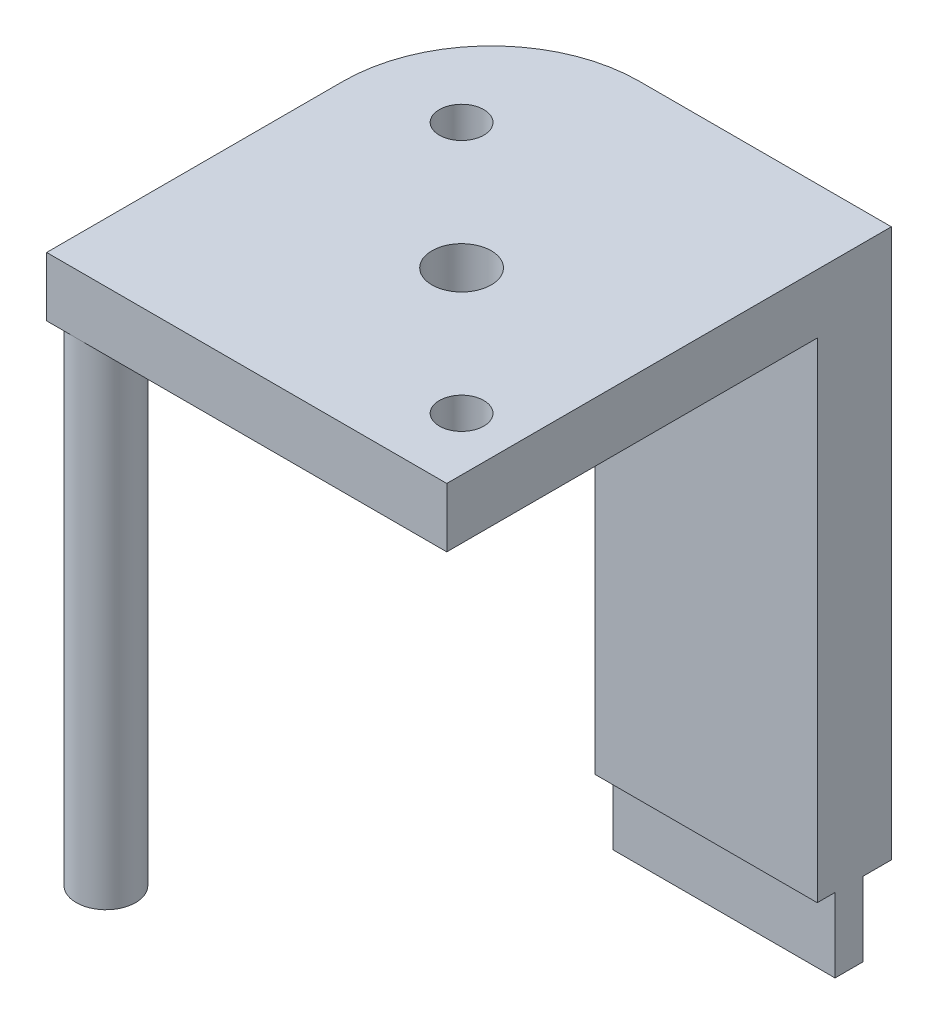
from build123d import *

# Parameters (mm, degrees)
EXTRUDE_1_DEPTH     = 37
CUT_EXTRUDE_1_DEPTH = 33
SKETCH_3_W          = 15
SKETCH_3_H          = 1.9
EXTRUDE_2_DEPTH     = 5
SKETCH_4_R          = 2
CUT_EXTRUDE_2_DEPTH = 10
SKETCH_5_R          = 1.5
CUT_EXTRUDE_3_DEPTH = 47.596673701


with BuildPart() as part:
    # 草图1 → 凸台-拉伸1 (new body)
    with BuildSketch(Plane(origin=(0, 0, 0), x_dir=(1, 0, 0), z_dir=(0, 1, 0))):
        with BuildLine():
            Line((-3.5, 15), (13.5, 15))
            Line((13.5, 15), (13.5, -15))
            Line((13.5, -15), (-13.5, -15))
            Line((-13.5, -15), (-13.5, 5))
            ThreePointArc((-13.5, 5), (-10.571067812, 12.071067812), (-3.5, 15))
        make_face()
    extrude(amount=EXTRUDE_1_DEPTH)

    # 草图2 → 切除-拉伸1 (cut)
    with BuildSketch(Plane(origin=(0, 0, 0), x_dir=(1, 0, 0), z_dir=(0, 1, 0))):
        with BuildLine():
            Line((-11.499999995, -15), (13.5, -15))
            Line((13.5, -15), (13.5, 10))
            Line((13.5, 10), (-1.5, 10))
            Line((-1.5, 10), (-1.5, 15))
            Line((-1.5, 15), (-13.5, 15))
            Line((-13.5, 15), (-13.5, -13))
            ThreePointArc((-13.5, -13), (-11.5, -11), (-9.5, -13))
            ThreePointArc((-9.5, -13), (-10.085786436, -14.414213561), (-11.499999995, -15))
        make_face()
        with BuildLine():
            Line((-13.5, -15), (-11.499999995, -15))
            ThreePointArc((-11.499999995, -15), (-12.914213561, -14.414213564), (-13.5, -13))
            Line((-13.5, -13), (-13.5, -15))
        make_face()
    extrude(amount=CUT_EXTRUDE_1_DEPTH, mode=Mode.SUBTRACT)

    # 草图3 → 凸台-拉伸2 (add)
    with BuildSketch(Plane.XZ):
        with Locations((6, -12.15)):
            Rectangle(SKETCH_3_W, SKETCH_3_H)
    extrude(amount=EXTRUDE_2_DEPTH)

    # 草图4 → 切除-拉伸2 (cut)
    with BuildSketch(Plane.XZ.offset(-33)):
        with Locations(Location((1.4, 1.9, 0), (0, 0, 270))):
            Circle(SKETCH_4_R)
    extrude(amount=-CUT_EXTRUDE_2_DEPTH, mode=Mode.SUBTRACT)

    # 草图5 → 切除-拉伸3 (cut, through all)
    with BuildSketch(Plane(origin=(0, 37, 0), x_dir=(1, 0, 0), z_dir=(0, 1, 0))):
        with Locations(Location((-7.1, 6.6, 0), (0, 0, 270))):
            Circle(SKETCH_5_R)
        with Locations(Location((9.9, -10.4, 0), (0, 0, 270))):
            Circle(SKETCH_5_R)
    extrude(amount=-CUT_EXTRUDE_3_DEPTH, mode=Mode.SUBTRACT)


solid = part.part
